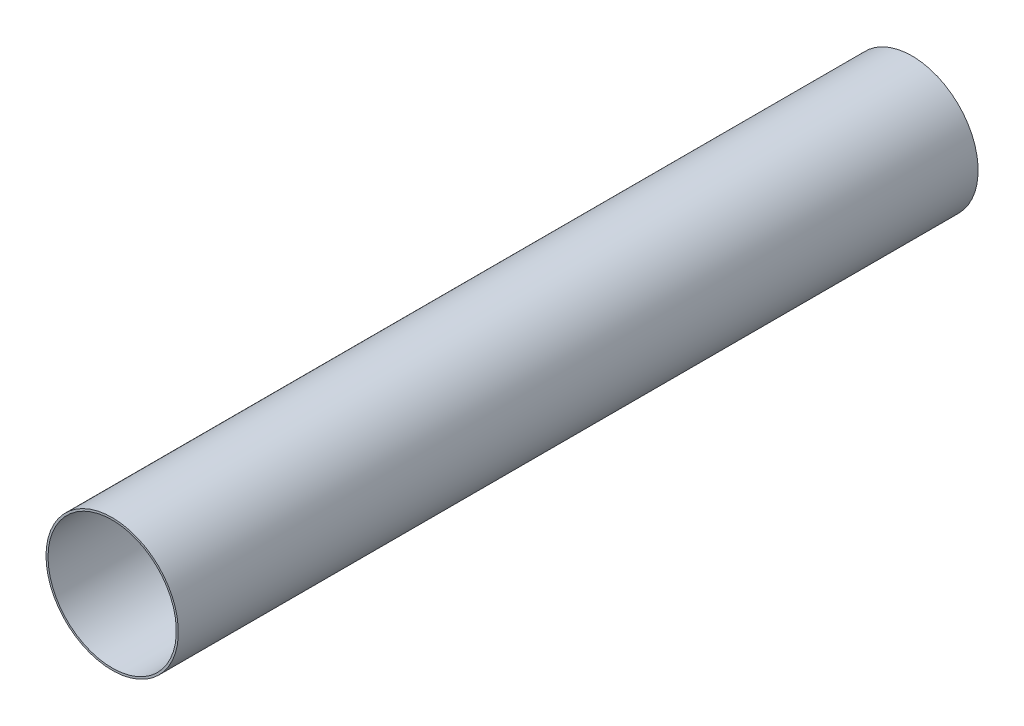
from build123d import *

# Parameters (mm, degrees)
SKETCH1_R           = 78.6
SKETCH1_R_2         = 76.2
BOSS_EXTRUDE1_DEPTH = 950


with BuildPart() as part:
    # Sketch1 → Boss-Extrude1 (new body)
    with BuildSketch(Plane.XY):
        with Locations(Location((0, 0, 0), (0, 0, 180))):
            Circle(SKETCH1_R)
        with Locations(Location((0, 0, 0), (0, 0, 180))):
            Circle(SKETCH1_R_2, mode=Mode.SUBTRACT)
    extrude(amount=BOSS_EXTRUDE1_DEPTH)


solid = part.part
